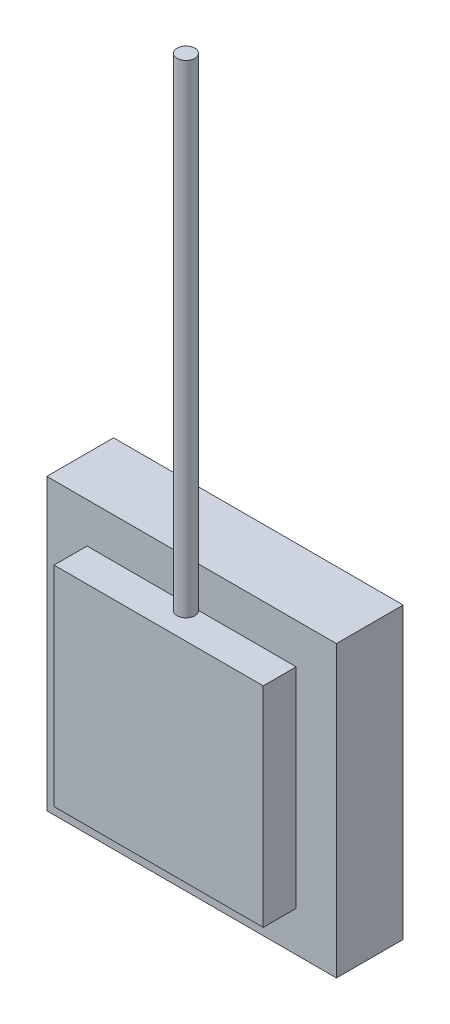
from build123d import *

# Parameters (mm, degrees)
SKETCH1_W           = 18
SKETCH1_H           = 18
BOSS_EXTRUDE1_DEPTH = 4.15
SKETCH2_W           = 13
SKETCH2_H           = 13
BOSS_EXTRUDE2_DEPTH = 2.05
SKETCH3_R           = 1.5
BOSS_EXTRUDE3_DEPTH = 0.5
SKETCH4_R           = 0.551632399
BOSS_EXTRUDE4_DEPTH = 30


with BuildPart() as part:
    # Sketch1 → Boss-Extrude1 (new body)
    with BuildSketch(Plane.XY):
        with Locations((9, 9)):
            Rectangle(SKETCH1_W, SKETCH1_H)
    extrude(amount=BOSS_EXTRUDE1_DEPTH)

    # Sketch2 → Boss-Extrude2 (add)
    with BuildSketch(Plane.XY.offset(4.15)):
        with Locations((9, 9)):
            Rectangle(SKETCH2_W, SKETCH2_H)
    extrude(amount=BOSS_EXTRUDE2_DEPTH)

    # Sketch3 → Boss-Extrude3 (add)
    with BuildSketch(Plane(origin=(0, 0, 0), x_dir=(-1, 0, 0), z_dir=(0, 0, -1))):
        with Locations((-10, 9)):
            Circle(SKETCH3_R)
    extrude(amount=BOSS_EXTRUDE3_DEPTH)

    # Sketch4 → Boss-Extrude4 (add)
    with BuildSketch(Plane(origin=(0, 15.5, 0), x_dir=(1, 0, 0), z_dir=(0, 1, 0))):
        with Locations(Location((9.049626603, -4.551632399, 0), (0, 0, 133.274343649))):
            Circle(SKETCH4_R)
    extrude(amount=BOSS_EXTRUDE4_DEPTH)


solid = part.part
